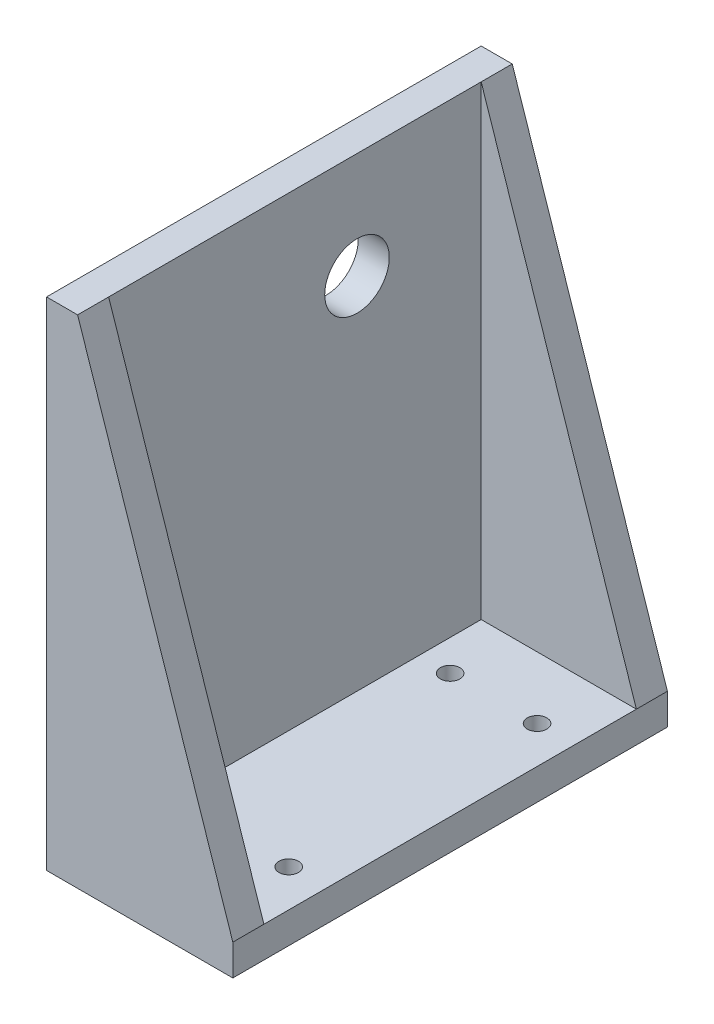
from build123d import *

# Parameters (mm, degrees)
BOSS_EXTRUDE1_DEPTH = 22.225
SKETCH2_R           = 3.302
CUT_EXTRUDE1_DEPTH  = 59.630138368
BOSS_EXTRUDE2_DEPTH = 3.175
SKETCH4_R           = 1.000000032
CUT_EXTRUDE2_DEPTH  = 56.901643536


with BuildPart() as part:
    # Sketch1 → Boss-Extrude1 (new, symmetric)
    with BuildSketch(Plane.XY):
        Polygon((0, 0), (0, 50.8), (3.175, 50.8), (3.175, 3.175), (19.05, 3.175), (19.05, 0), align=None)
    extrude(amount=BOSS_EXTRUDE1_DEPTH, both=True)

    # Sketch2 → Cut-Extrude1 (cut, through all)
    with BuildSketch(Plane.ZY):
        with Locations((-6.35, 39.9542)):
            Circle(SKETCH2_R)
    extrude(amount=-CUT_EXTRUDE1_DEPTH, mode=Mode.SUBTRACT)

    # Sketch3 → Boss-Extrude2 (add)
    with BuildSketch(Plane.XY.offset(22.225)):
        Polygon((3.175, 50.8), (19.05, 3.175), (3.175, 3.175), align=None)
    boss_extrude2 = extrude(amount=-BOSS_EXTRUDE2_DEPTH)

    # Mirror1: Boss-Extrude2 across plane
    add(boss_extrude2.mirror(Plane.XY))

    # Sketch4 → Cut-Extrude2 (cut, through all)
    with BuildSketch(Plane(origin=(0, 3.175, 0), x_dir=(1, 0, 0), z_dir=(0, 1, 0))):
        with Locations(Location((6.35, 12.7, 0), (0, 0, 180))):
            Circle(SKETCH4_R)
        with Locations(Location((15.24, 12.7, 0), (0, 0, 180))):
            Circle(SKETCH4_R)
        with Locations((15.24, -12.7)):
            Circle(SKETCH4_R)
        with Locations((6.35, -12.7)):
            Circle(SKETCH4_R)
    extrude(amount=-CUT_EXTRUDE2_DEPTH, mode=Mode.SUBTRACT)


solid = part.part
